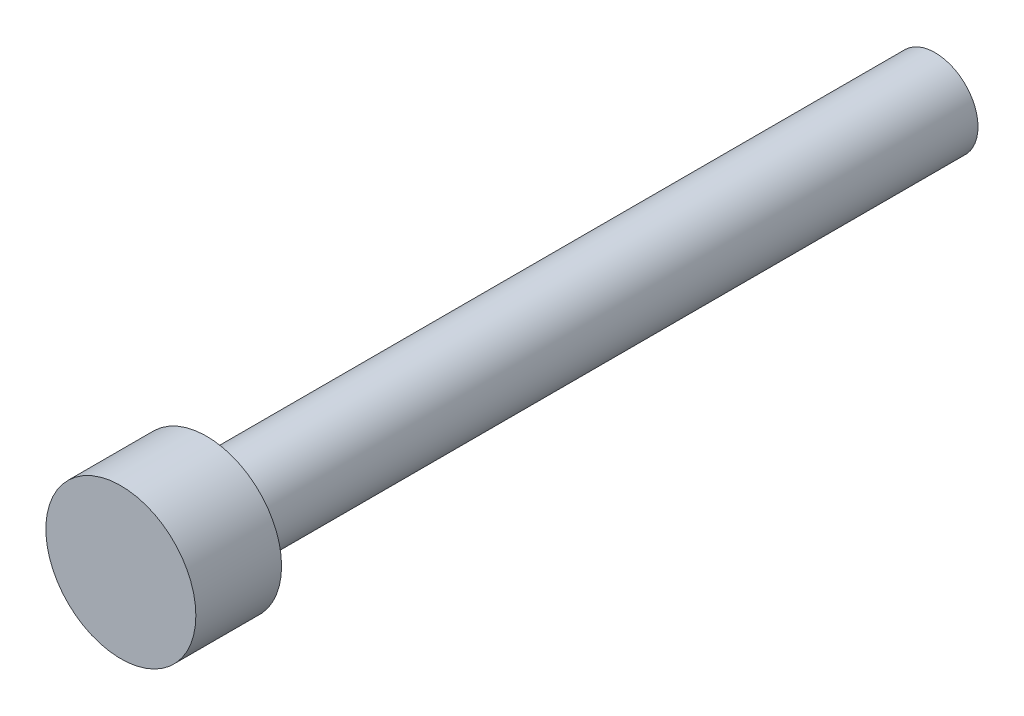
from build123d import *

# Parameters (mm, degrees)
ESQUISSE1_R        = 2
BOSS_EXTRU_1_DEPTH = 34
ESQUISSE2_R        = 3.5
BOSS_EXTRU_2_DEPTH = 4


with BuildPart() as part:
    # Esquisse1 → Boss.-Extru.1 (new body)
    with BuildSketch(Plane.XY):
        Circle(ESQUISSE1_R)
    extrude(amount=BOSS_EXTRU_1_DEPTH)

    # Esquisse2 → Boss.-Extru.2 (add)
    with BuildSketch(Plane.XY.offset(34)):
        Circle(ESQUISSE2_R)
    extrude(amount=BOSS_EXTRU_2_DEPTH)


solid = part.part
